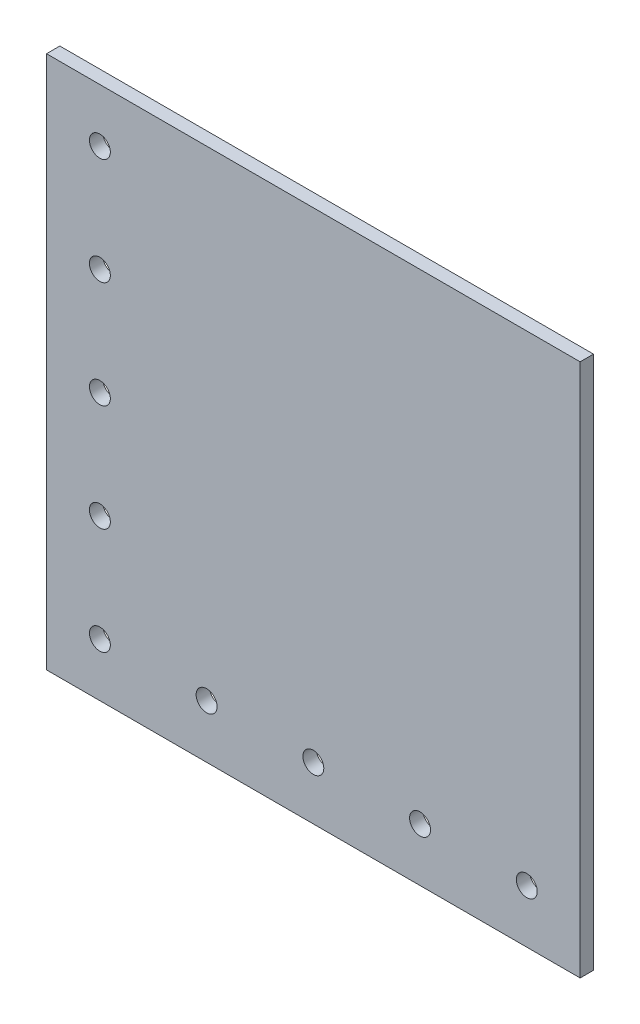
from build123d import *

# Parameters (mm, degrees)
SKETCH1_R           = 2.4892
BOSS_EXTRUDE1_DEPTH = 1.5875


with BuildPart() as part:
    # Sketch1 → Boss-Extrude1 (new, symmetric)
    with BuildSketch(Plane.XY):
        Polygon((0, 127), (0, 0), (127, 0), (127, 25.4), (127, 127), align=None)
        with Locations((114.3, 12.7)):
            Circle(SKETCH1_R, mode=Mode.SUBTRACT)
        with Locations((88.9, 12.7)):
            Circle(SKETCH1_R, mode=Mode.SUBTRACT)
        with Locations((63.5, 12.7)):
            Circle(SKETCH1_R, mode=Mode.SUBTRACT)
        with Locations((38.1, 12.7)):
            Circle(SKETCH1_R, mode=Mode.SUBTRACT)
        with Locations((12.7, 12.7)):
            Circle(SKETCH1_R, mode=Mode.SUBTRACT)
        with Locations((12.7, 38.1)):
            Circle(SKETCH1_R, mode=Mode.SUBTRACT)
        with Locations((12.7, 63.5)):
            Circle(SKETCH1_R, mode=Mode.SUBTRACT)
        with Locations((12.7, 88.9)):
            Circle(SKETCH1_R, mode=Mode.SUBTRACT)
        with Locations((12.7, 114.3)):
            Circle(SKETCH1_R, mode=Mode.SUBTRACT)
    extrude(amount=BOSS_EXTRUDE1_DEPTH, both=True)


solid = part.part
